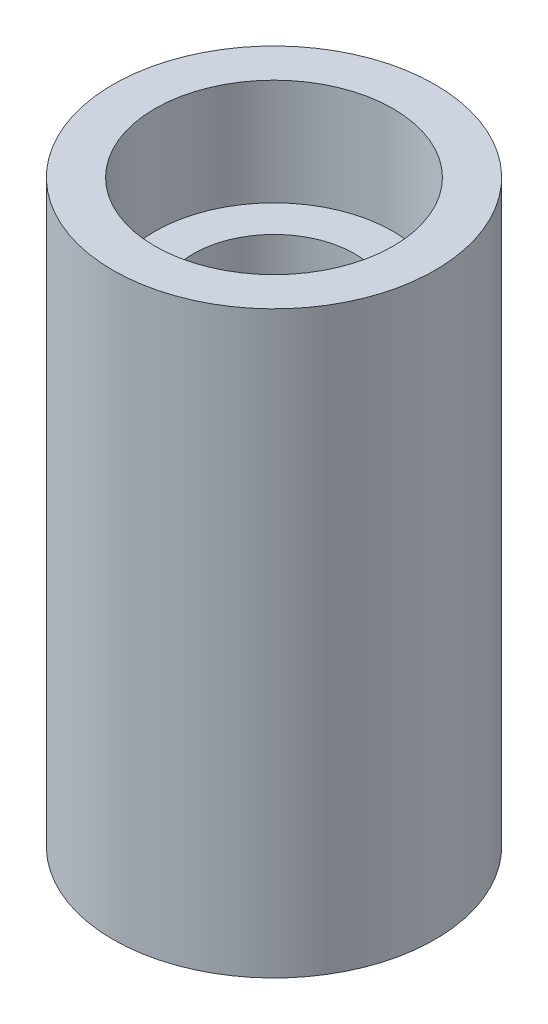
from build123d import *

# Parameters (mm, degrees)
SKETCH1_R           = 5
SKETCH1_R_2         = 2.5
BOSS_EXTRUDE1_DEPTH = 18
SKETCH2_R           = 3.7
SKETCH2_R_2         = 2.5
CUT_EXTRUDE1_DEPTH  = 3.3
CUT_EXTRUDE2_START  = -14.7
SKETCH2_2_R         = 3.7
SKETCH2_2_R_2       = 2.5
CUT_EXTRUDE2_DEPTH  = 3.3


with BuildPart() as part:
    # Sketch1 → Boss-Extrude1 (new body)
    with BuildSketch(Plane(origin=(0, 0, 0), x_dir=(1, 0, 0), z_dir=(0, 1, 0))):
        with Locations(Location((0, 0, 0), (0, 0, 270))):
            Circle(SKETCH1_R)
        with Locations(Location((0, 0, 0), (0, 0, 270))):
            Circle(SKETCH1_R_2, mode=Mode.SUBTRACT)
    extrude(amount=BOSS_EXTRUDE1_DEPTH)

    # Sketch2 → Cut-Extrude1 (cut)
    with BuildSketch(Plane.XZ):
        with Locations(Location((0, 0, 0), (0, 0, 270))):
            Circle(SKETCH2_R)
        with Locations(Location((0, 0, 0), (0, 0, 270))):
            Circle(SKETCH2_R_2, mode=Mode.SUBTRACT)
    extrude(amount=-CUT_EXTRUDE1_DEPTH, mode=Mode.SUBTRACT)

    # Sketch2<2> → Cut-Extrude2 (cut)
    with BuildSketch(Plane.XZ.offset(CUT_EXTRUDE2_START)):
        with Locations(Location((0, 0, 0), (0, 0, 270))):
            Circle(SKETCH2_2_R)
        with Locations(Location((0, 0, 0), (0, 0, 270))):
            Circle(SKETCH2_2_R_2, mode=Mode.SUBTRACT)
    extrude(amount=-CUT_EXTRUDE2_DEPTH, mode=Mode.SUBTRACT)


solid = part.part
